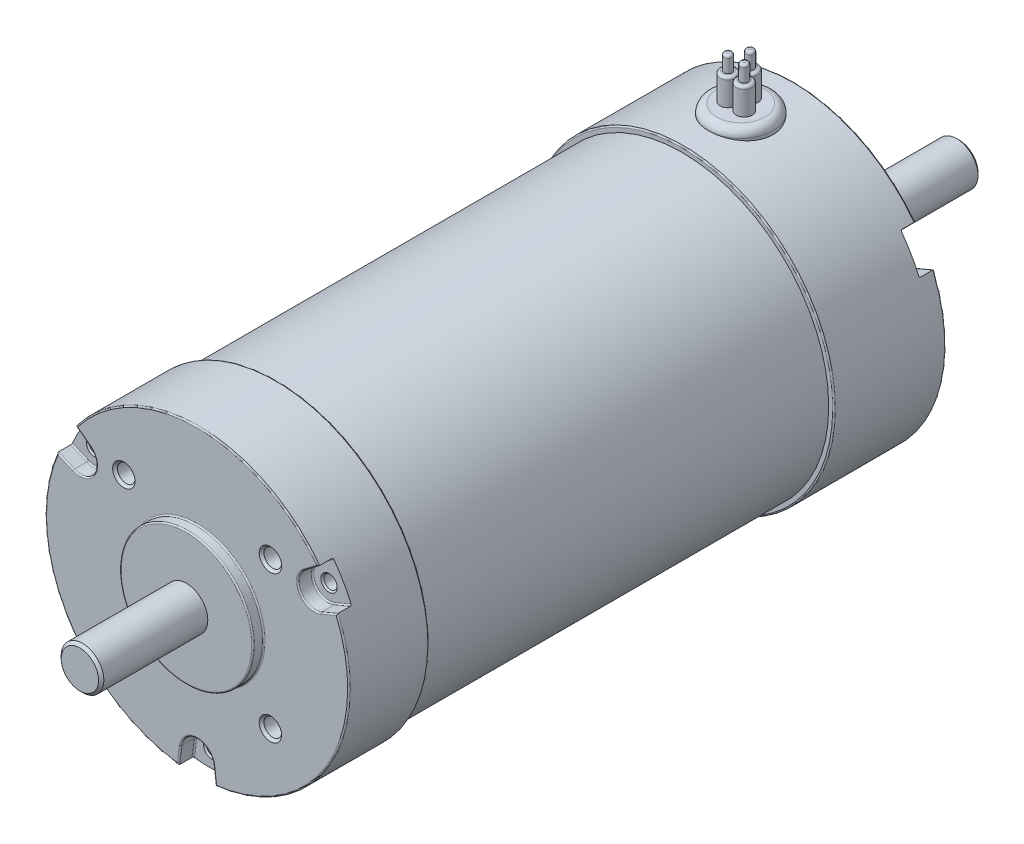
from build123d import *

# Parameters (mm, degrees)
MOTOR_BODY_SKETCH_R                 = 28.5
MOTOR_BODY_DEPTH                    = 56
MOTOR_START                         = 3
MOTOR_BODY_CUT_OUT_SKETCH_OUTSIDE_W = 86.598
MOTOR_BODY_CUT_OUT_SKETCH_OUTSIDE_H = 86.598
MOTOR_BODY_CUT_OUT_SKETCH_OUTSIDE_R = 27.500000000000004
MOTOR_BODY_CUT_OUT_DEPTH            = 38
FLANGE_SKETCH_R                     = 12.5
FLANGE_DEPTH                        = 2
SHAFT_START                         = -4.5
SHAFT_SKETCH_R                      = 4
SHAFT_DEPTH                         = 82.5
FIXING_BOLTS_HEAD_CUT_OUT_F_DEPTH   = 2.75
FIXING_HOLES_AT_2_COUNT             = 2
FIXING_HOLES_AT_2_PITCH             = 43.994090512249485
FIXING_HOLES_AT_3_COUNT             = 2
FIXING_HOLES_AT_3_PITCH             = 43.994090512249485
FRONT_FIXING_HOLES_D                = 3.3
FRONT_FIXING_HOLES_DEPTH            = 11.5
FRONT_FIXING_HOLES_CSINK_D          = 4.2
FRONT_FIXING_HOLES_CSINK_ANGLE      = 90
FRONT_FIXING_HOLES_TIP              = 0.9914200213954745
AESTHETIC_CHAMFER_SIZE              = 0.5
PRODUCTION_FILLET_R                 = 0.25
WIRES_RUBBER_SKETCH_R               = 5.999999999999999
WIRES_RUBBER_DEPTH                  = 30
RUBBER_FILLET_R                     = 1.5
WIRES_INSULATION_SKETCH_R           = 1.5000000000000022
WIRES_INSULATION_DEPTH              = 5
WIRES_WIRES_SKETCH_R                = 0.7499999999999991
WIRES_WIRES_DEPTH                   = 3
WIRES_FILLET_R                      = 0.5
WIRES_2_COUNT                       = 3
WIRES_FILLET_OF_WIRES_2_R           = 0.5


with BuildPart() as part:
    # Motor Body Sketch → Motor Body (new, symmetric)
    with BuildSketch(Plane.XY):
        Circle(MOTOR_BODY_SKETCH_R)
    extrude(amount=MOTOR_BODY_DEPTH, both=True)

    # Motor Body Cut Out Sketch outside → Motor Body Cut Out (cut, symmetric)
    with BuildSketch(Plane.XY.offset(MOTOR_START)):
        Rectangle(MOTOR_BODY_CUT_OUT_SKETCH_OUTSIDE_W, MOTOR_BODY_CUT_OUT_SKETCH_OUTSIDE_H)
        Circle(MOTOR_BODY_CUT_OUT_SKETCH_OUTSIDE_R, mode=Mode.SUBTRACT)
    extrude(amount=MOTOR_BODY_CUT_OUT_DEPTH, both=True, mode=Mode.SUBTRACT)

    # Flange Sketch → Flange (add)
    with BuildSketch(Plane.XY.offset(56)):
        Circle(FLANGE_SKETCH_R)
    extrude(amount=FLANGE_DEPTH)

    # Shaft Sketch → Shaft (add, symmetric)
    with BuildSketch(Plane.XY.offset(SHAFT_START)):
        Circle(SHAFT_SKETCH_R)
    extrude(amount=SHAFT_DEPTH, both=True)

    # Fixing Bolts Head Cut Out Sketch → Fixing Bolts Head Cut Out F (cut)
    with BuildSketch(Plane.XY.offset(56)):
        with BuildLine():
            Line((22.75803741787635, 17.15580755565124), (20.13097496059779, 15.175435648961937))
            ThreePointArc((20.13097496059779, 15.175435648961937), (19.312366504393008, 11.149999999999958), (23.207800265795964, 9.84621789434505))
            Line((23.207800265795964, 9.84621789434505), (26.23638387456922, 11.13113476633195))
            ThreePointArc((26.23638387456922, 11.13113476633195), (24.681724007856538, 14.249999999999924), (22.75803741787635, 17.15580755565124))
        make_face()
        with BuildLine():
            Line((-3.478346456692974, -28.28694232198332), (-3.0768253051982453, -25.02165354330709))
            ThreePointArc((-3.0768253051982453, -25.02165354330709), (-4.617e-14, -22.300000000000008), (3.0768253051981316, -25.0216535433071))
            Line((3.0768253051981316, -25.0216535433071), (3.47834645669282, -28.28694232198335))
            ThreePointArc((3.47834645669282, -28.28694232198335), (-7.419e-14, -28.499999999999996), (-3.478346456692974, -28.28694232198332))
        make_face()
        with BuildLine():
            Line((-22.75803741787625, 17.15580755565136), (-20.130974960597726, 15.175435648962019))
            ThreePointArc((-20.130974960597726, 15.175435648962019), (-19.312366504392955, 11.150000000000027), (-23.207800265795935, 9.846217894345141))
            Line((-23.207800265795935, 9.846217894345141), (-26.23638387456917, 11.131134766332082))
            ThreePointArc((-26.23638387456917, 11.131134766332082), (-24.68172400785647, 14.250000000000052), (-22.75803741787625, 17.15580755565136))
        make_face()
    fixing_bolts_head_cut_out_f = extrude(amount=-FIXING_BOLTS_HEAD_CUT_OUT_F_DEPTH, mode=Mode.SUBTRACT)

    # Sketch8 → Fixing Holes (revolve, cut)
    with BuildSketch(Plane(origin=(21.99704525612477, 12.699999999999951, 53.25), x_dir=(0, -1, 0), z_dir=(1, 0, 0))):
        Polygon((0, 0), (-2.29e-15, 9.251075773784452), (1.2499999999999976, 8.5), (1.2499999999999984, 0.2749999999999992), (1.525, 0), align=None)
    fixing_holes = revolve(axis=Axis((21.99704525612477, 12.699999999999951, 59.599999999999994), (0, 0, -1)), mode=Mode.SUBTRACT)

    # Fixing Holes at 2: Fixing Holes ×2
    with Locations(*[(-i * FIXING_HOLES_AT_2_PITCH, 0, 0) for i in range(1, FIXING_HOLES_AT_2_COUNT)]):
        add(fixing_holes, mode=Mode.SUBTRACT)

    # Fixing Holes at 3: Fixing Holes ×2
    with Locations(*[Vector(-0.500000000000002, -0.8660254037844376, 0) * (i * FIXING_HOLES_AT_3_PITCH) for i in range(1, FIXING_HOLES_AT_3_COUNT)]):
        add(fixing_holes, mode=Mode.SUBTRACT)

    # Fixing Bolts Back: Fixing Bolts Head Cut Out F, Fixing Holes across plane
    add(fixing_bolts_head_cut_out_f.mirror(Plane.XY), mode=Mode.SUBTRACT)
    add(fixing_holes.mirror(Plane.XY), mode=Mode.SUBTRACT)

    # Fixing Bolts Back copy 1 sketch → Fixing Bolts Back copy 1 (revolve, cut)
    with BuildSketch(Plane(origin=(-21.997045256124714, 12.70000000000004, -53.25), x_dir=(0, -1, 0), z_dir=(1, 0, 0))):
        Polygon((0, 0), (-2.29e-15, -9.251075773784452), (1.2499999999999976, -8.5), (1.2499999999999984, -0.2749999999999992), (1.525, 0), align=None)
    revolve(axis=Axis((-21.997045256124714, 12.70000000000004, -59.599999999999994), (0, 0, -1)), mode=Mode.SUBTRACT)

    # Fixing Bolts Back copy 2 sketch → Fixing Bolts Back copy 2 (revolve, cut)
    with BuildSketch(Plane(origin=(-6.04e-14, -25.400000000000006, -53.25), x_dir=(0, -1, 0), z_dir=(1, 0, 0))):
        Polygon((0, 0), (-2.29e-15, -9.251075773784452), (1.2499999999999976, -8.5), (1.2499999999999984, -0.2749999999999992), (1.525, 0), align=None)
    revolve(axis=Axis((-6.04e-14, -25.400000000000006, -59.599999999999994), (0, 0, -1)), mode=Mode.SUBTRACT)

    # Front Fixing Holes
    with Locations(Plane.XY.offset(56)):
        with Locations((13.75, -13.75), (-13.75, -13.75), (-13.75, 13.75), (13.75, 13.75)):
            CounterSinkHole(FRONT_FIXING_HOLES_D / 2, FRONT_FIXING_HOLES_CSINK_D / 2, depth=FRONT_FIXING_HOLES_DEPTH, counter_sink_angle=FRONT_FIXING_HOLES_CSINK_ANGLE)
            with Locations((0, 0, -(FRONT_FIXING_HOLES_DEPTH + FRONT_FIXING_HOLES_TIP / 2))):  # 118° drill point
                Cone(0, FRONT_FIXING_HOLES_D / 2, FRONT_FIXING_HOLES_TIP, mode=Mode.SUBTRACT)

    # Aesthetic Chamfer
    aesthetic_chamfer_edges = [part.edges().sort_by_distance(p)[0] for p in [
        (-4, 4.9e-16, -87),
        (-4, 4.9e-16, 78),
    ]]
    chamfer(aesthetic_chamfer_edges, length=AESTHETIC_CHAMFER_SIZE)

    # Production Fillet
    production_fillet_edges = [part.edges().sort_by_distance(p)[0] for p in [
        (21.444506189237067, 16.165621602306587, -56),
        (19.312366504393008, 11.149999999999956, -56),
        (24.722092070182594, 10.488676330338501, -56),
        (21.444506189237067, 16.165621602306587, -53.25),
        (19.312366504393008, 11.149999999999956, -53.25),
        (24.722092070182594, 10.488676330338501, -53.25),
        (3.277585880945476, -26.654297932645225, -56),
        (-5.146e-14, -22.300000000000008, -56),
        (-3.2775858809456095, -26.654297932645207, -56),
        (3.277585880945476, -26.654297932645225, -53.25),
        (-5.146e-14, -22.300000000000008, -53.25),
        (-3.2775858809456095, -26.654297932645207, -53.25),
        (-24.722092070182555, 10.488676330338611, -56),
        (-19.31236650439296, 11.150000000000023, -56),
        (-21.44450618923699, 16.16562160230669, -56),
        (-24.722092070182555, 10.488676330338611, -53.25),
        (-19.31236650439296, 11.150000000000023, -53.25),
        (-21.44450618923699, 16.16562160230669, -53.25),
        (-12.5, 1.53e-15, 56),
        (-12.5, 1.53e-15, 58),
        (7.768e-14, 28.5, 56),
        (-24.681724007856538, -14.249999999999938, 56),
        (21.346930388415856, -18.882758352320447, 56),
        (24.72209207018259, 10.4886763303385, 53.25),
        (19.312366504393008, 11.149999999999956, 53.25),
        (21.444506189237067, 16.16562160230659, 53.25),
        (21.444506189237067, 16.16562160230659, 56),
        (19.312366504393008, 11.149999999999956, 56),
        (24.72209207018259, 10.4886763303385, 56),
        (-3.2775858809456095, -26.654297932645207, 53.25),
        (-5.146e-14, -22.300000000000008, 53.25),
        (3.277585880945476, -26.654297932645225, 53.25),
        (3.277585880945476, -26.654297932645225, 56),
        (-5.146e-14, -22.300000000000008, 56),
        (-3.2775858809456095, -26.654297932645207, 56),
        (-21.44450618923699, 16.16562160230669, 53.25),
        (-19.31236650439296, 11.150000000000023, 53.25),
        (-24.722092070182555, 10.488676330338611, 53.25),
        (-24.722092070182555, 10.488676330338611, 56),
        (-19.31236650439296, 11.150000000000023, 56),
        (-21.44450618923699, 16.16562160230669, 56),
        (-28.5, 3.49e-15, 41),
        (-28.5, 3.49e-15, -35),
        (7.768e-14, 28.5, -56),
        (-24.681724007856538, -14.249999999999938, -56),
        (21.346930388415856, -18.882758352320447, -56),
    ]]
    fillet(production_fillet_edges, radius=PRODUCTION_FILLET_R)

    # Wires Rubber Sketch → Wires Rubber (add)
    with BuildSketch(Plane(origin=(0, 0, 0), x_dir=(1, 0, 0), z_dir=(0, 1, 0))):
        with Locations(Location((0, 46, 0), (0, 0, 90))):
            Circle(WIRES_RUBBER_SKETCH_R)
    extrude(amount=WIRES_RUBBER_DEPTH)

    # Rubber Fillet
    rubber_fillet_edges = [part.edges().sort_by_distance(p)[0] for p in [
        (-1.1e-15, 30, -40),
    ]]
    fillet(rubber_fillet_edges, radius=RUBBER_FILLET_R)

    # Wires Insulation Sketch → Wires Insulation (add)
    with BuildSketch(Plane(origin=(0, 30, 0), x_dir=(1, 0, 0), z_dir=(0, 1, 0))):
        with Locations(Location((0, 47.75, 0), (0, 0, 270))):
            Circle(WIRES_INSULATION_SKETCH_R)
    wires_insulation = extrude(amount=WIRES_INSULATION_DEPTH)

    # Wires Wires Sketch → Wires Wires (add)
    with BuildSketch(Plane(origin=(0, 34.99999999999999, 0), x_dir=(1, 0, 0), z_dir=(0, 1, 0))):
        with Locations(Location((0, 47.75, 0), (0, 0, 270))):
            Circle(WIRES_WIRES_SKETCH_R)
    wires_wires = extrude(amount=WIRES_WIRES_DEPTH)

    # Wires Fillet
    wires_fillet_edges = [part.edges().sort_by_distance(p)[0] for p in [
        (4.6e-16, 35, -49.25),
        (2.3e-16, 37.99999999999999, -48.5),
    ]]
    fillet(wires_fillet_edges, radius=WIRES_FILLET_R)

    # Wires 2: Wires Insulation, Wires Wires ×3 about axis
    wires_2_axis = Axis((0, 0, -46.000000000000014), (0, 1, 0))
    add([wires_insulation.rotate(wires_2_axis, i * 360 / WIRES_2_COUNT) for i in range(1, WIRES_2_COUNT)])
    add([wires_wires.rotate(wires_2_axis, i * 360 / WIRES_2_COUNT) for i in range(1, WIRES_2_COUNT)])

    # Wires Fillet of Wires 2
    wires_fillet_of_wires_2_edges = [part.edges().sort_by_distance(p)[0] for p in [
        (-2.814582562299414, 35, -44.37500000000003),
        (-2.165063509461085, 37.99999999999999, -44.75000000000003),
        (2.814582562299414, 35, -44.37500000000002),
        (2.165063509461085, 37.99999999999999, -44.75000000000002),
    ]]
    fillet(wires_fillet_of_wires_2_edges, radius=WIRES_FILLET_OF_WIRES_2_R)


solid = part.part
